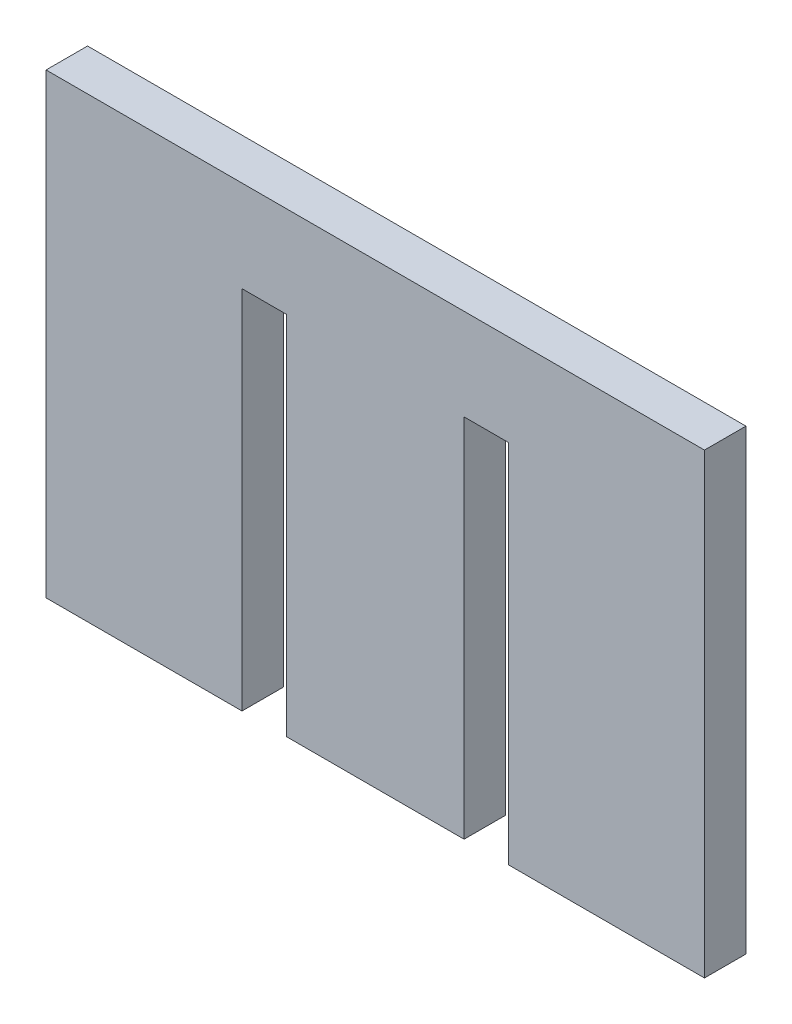
from build123d import *

# Parameters (mm, degrees)
BOSS_EXTRUDE1_DEPTH = 3.175


with BuildPart() as part:
    # Sketch1 → Boss-Extrude1 (new body)
    with BuildSketch(Plane.XY):
        Polygon((0, 0), (0, 35), (50.4, 35), (50.4, 0), (35.4, 0), (35.4, 28), (32, 28), (32, 0), (18.4, 0), (18.4, 28), (15, 28), (15, 0), align=None)
    extrude(amount=BOSS_EXTRUDE1_DEPTH)


solid = part.part
